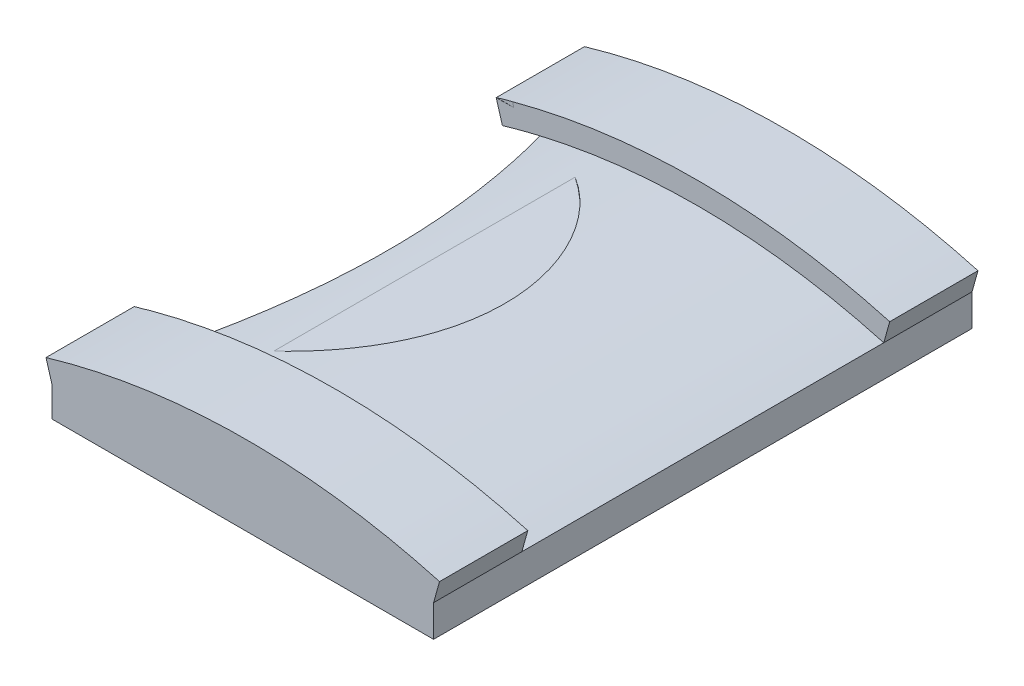
from build123d import *

# Parameters (mm, degrees)
BOSS_EXTRUDE1_DEPTH = 610
CUT_EXTRUDE1_DEPTH  = 610
CUT_EXTRUDE2_DEPTH  = 703.283548499
BOSS_EXTRUDE2_DEPTH = 100
BOSS_EXTRUDE3_START = -100
BOSS_EXTRUDE3_DEPTH = 100
CUT_REVOLVE3_ANGLE  = 106


with BuildPart() as part:
    # Sketch1 → Boss-Extrude1 (new body)
    with BuildSketch(Plane.XY):
        Polygon((-89.824548177, 33.388821274), (-89.824548177, -2.611178726), (342.175451823, -2.611178726), (342.175451823, 33.388821274), (342.175451823, 63.388821274), (-89.824548177, 63.388821274), align=None)
    extrude(amount=BOSS_EXTRUDE1_DEPTH)

    # Sketch2 → Cut-Extrude1 (cut)
    with BuildSketch(Plane(origin=(0, 63.388821274, 0), x_dir=(1, 0, 0), z_dir=(0, 1, 0))):
        with BuildLine():
            Line((-89.824548177, 0), (-89.824548177, -610))
            ThreePointArc((-89.824548177, -610), (-14.065137005, -305), (-89.824548177, 0))
        make_face()
    extrude(amount=-CUT_EXTRUDE1_DEPTH, mode=Mode.SUBTRACT)

    # Sketch3 → Cut-Extrude2 (cut, through all)
    with BuildSketch(Plane.XY.offset(610)):
        with BuildLine():
            Line((-89.824548177, 30.388821274), (-89.824548177, 63.388821274))
            Line((-89.824548177, 63.388821274), (342.175451823, 63.388821274))
            Line((342.175451823, 63.388821274), (342.175451823, 33.388821274))
            ThreePointArc((342.175451823, 33.388821274), (125.963985264, 62.340005792), (-89.824548177, 30.388821274))
        make_face()
    extrude(amount=-CUT_EXTRUDE2_DEPTH, mode=Mode.SUBTRACT)

    # Sketch4 → Boss-Extrude2 (add)
    with BuildSketch(Plane.XY.offset(610)):
        with BuildLine():
            Line((-96.902742964, 54.365876109), (-89.824548177, 30.388821274))
            ThreePointArc((-89.824548177, 30.388821274), (125.963985264, 62.340005792), (342.175451823, 33.388821274))
            Line((342.175451823, 33.388821274), (348.919965355, 57.461867139))
            ThreePointArc((348.919965355, 57.461867139), (125.790378339, 87.339402998), (-96.902742964, 54.365876109))
        make_face()
    extrude(amount=-BOSS_EXTRUDE2_DEPTH)

    # Sketch5 → Boss-Extrude3 (add)
    with BuildSketch(Plane(origin=(0, 0, 0), x_dir=(-1, 0, 0), z_dir=(0, 0, -1)).offset(BOSS_EXTRUDE3_START)):
        with BuildLine():
            Line((-348.919965355, 57.461867139), (-342.175451823, 33.388821274))
            ThreePointArc((-342.175451823, 33.388821274), (-125.963985264, 62.340005792), (89.824548177, 30.388821274))
            Line((89.824548177, 30.388821274), (96.902742964, 54.365876109))
            ThreePointArc((96.902742964, 54.365876109), (-125.790378339, 87.339402998), (-348.919965355, 57.461867139))
        make_face()
    extrude(amount=BOSS_EXTRUDE3_DEPTH)

    # Sketch6 → Cut-Revolve3 (revolve, cut)
    with BuildSketch(Plane(origin=(-74.37222514, -21.955202584, 0), x_dir=(0, 0, 1), z_dir=(-0.9590821933998281, -0.2831277914712271, 0))):
        with BuildLine():
            Line((100, 79.577203308), (510, 79.577203308))
            ThreePointArc((510, 79.577203308), (305, 294.560025587), (100, 79.577203308))
        make_face()
    revolve(axis=Axis((-96.902742964, 54.365876109, 100), (0, 0, -1)), revolution_arc=CUT_REVOLVE3_ANGLE, mode=Mode.SUBTRACT)


solid = part.part
